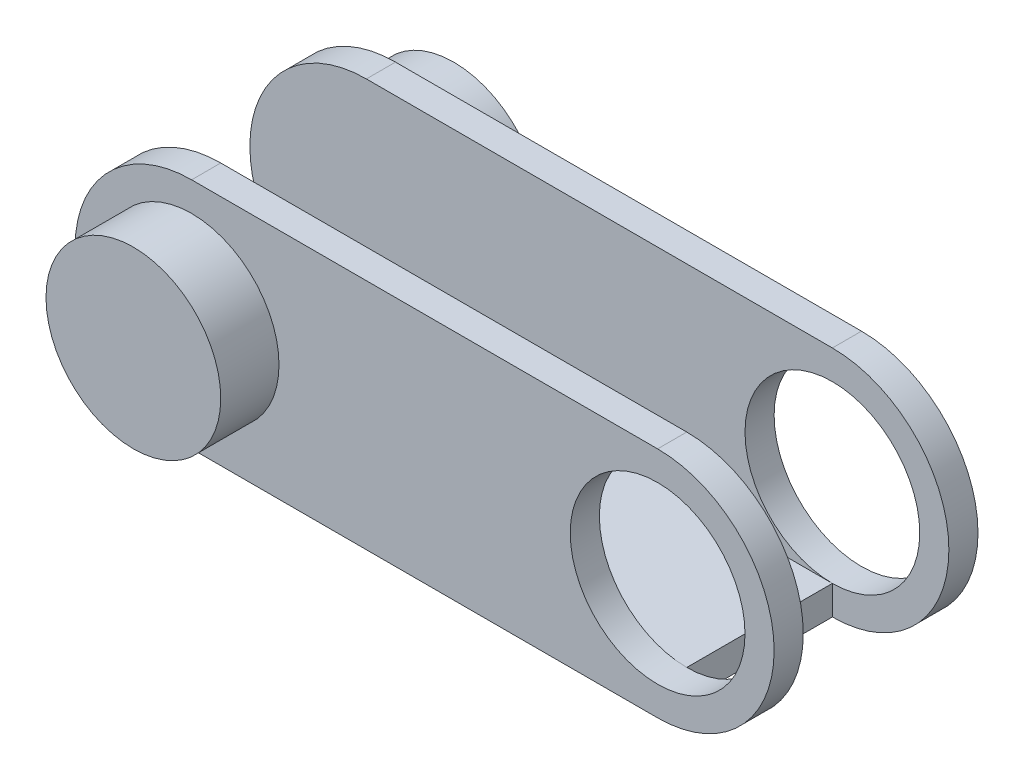
from build123d import *

# Parameters (mm, degrees)
SKETCH2_R           = 30
BOSS_EXTRUDE1_DEPTH = 10
SKETCH3_R           = 30
BOSS_EXTRUDE2_DEPTH = 20
SKETCH5_W           = 160
SKETCH5_H           = 60
BOSS_EXTRUDE3_DEPTH = 10


with BuildPart() as part:
    # Sketch2 → Boss-Extrude1 (new body)
    with BuildSketch(Plane.XY):
        with BuildLine():
            Line((0, -40), (-160, -40))
            ThreePointArc((-160, -40), (-200, 0), (-160, 40))
            Line((-160, 40), (0, 40))
            ThreePointArc((0, 40), (40, 0), (0, -40))
        make_face()
        Circle(SKETCH2_R, mode=Mode.SUBTRACT)
    boss_extrude1 = extrude(amount=BOSS_EXTRUDE1_DEPTH)

    # Sketch3 → Boss-Extrude2 (add)
    with BuildSketch(Plane.XY.offset(10)):
        with Locations((-160, 0)):
            Circle(SKETCH3_R)
    boss_extrude2 = extrude(amount=BOSS_EXTRUDE2_DEPTH)

    # Sketch5 → Boss-Extrude3 (add)
    with BuildSketch(Plane.XZ.offset(40)):
        with Locations((-80, -30)):
            Rectangle(SKETCH5_W, SKETCH5_H)
    extrude(amount=-BOSS_EXTRUDE3_DEPTH)

    # Mirror1: Boss-Extrude1, Boss-Extrude2 across plane
    add(boss_extrude1.mirror(Plane(origin=(0, 0, -25), x_dir=(1, 0, 0), z_dir=(0, 0, -1))))
    add(boss_extrude2.mirror(Plane(origin=(0, 0, -25), x_dir=(1, 0, 0), z_dir=(0, 0, -1))))


solid = part.part
